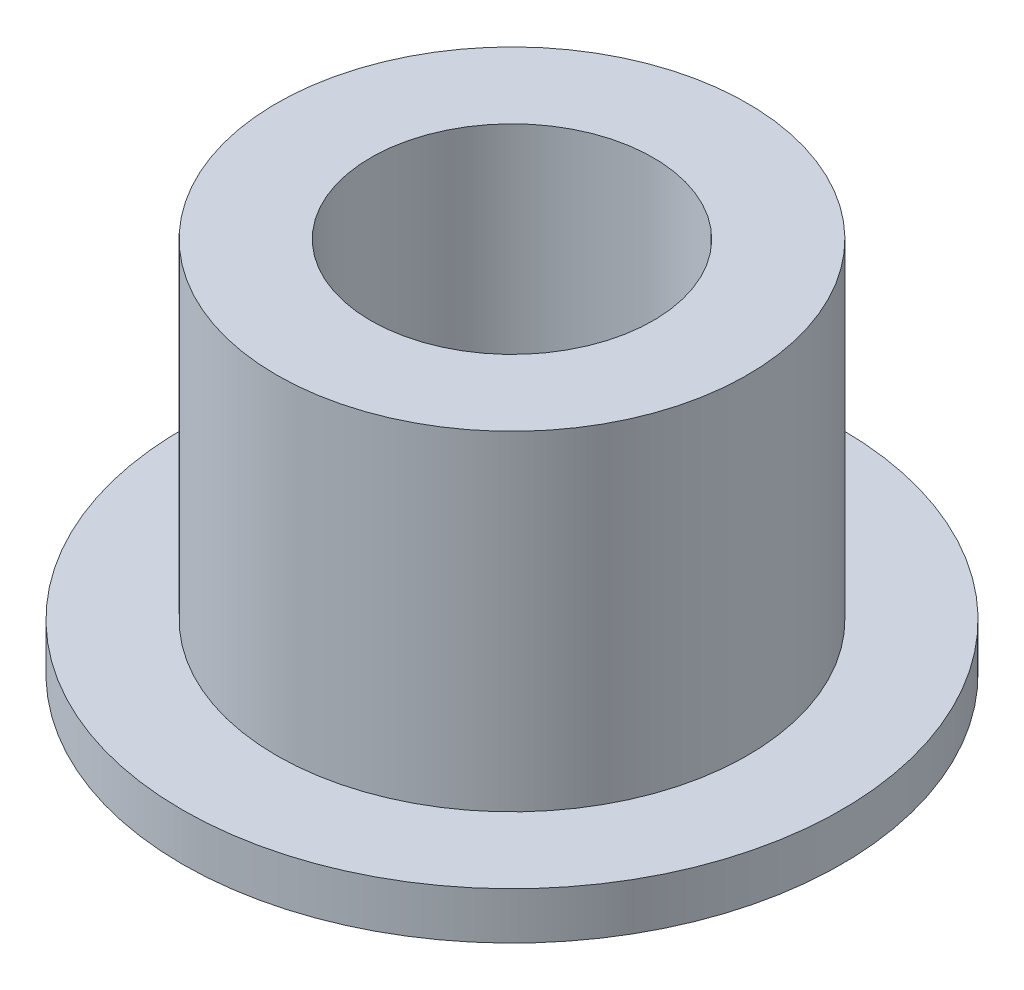
from build123d import *

# Parameters (mm, degrees)
SKETCH1_R           = 11.1125
SKETCH1_R_2         = 4.7625
BOSS_EXTRUDE1_DEPTH = 1.5875
SKETCH2_R           = 7.9375
SKETCH2_R_2         = 4.7625
BOSS_EXTRUDE2_DEPTH = 11.1125


with BuildPart() as part:
    # Sketch1 → Boss-Extrude1 (new body)
    with BuildSketch(Plane(origin=(0, 0, 0), x_dir=(1, 0, 0), z_dir=(0, 1, 0))):
        with Locations(Location((0, 0, 0), (0, 0, 270))):
            Circle(SKETCH1_R)
        with Locations(Location((0, 0, 0), (0, 0, 270))):
            Circle(SKETCH1_R_2, mode=Mode.SUBTRACT)
    extrude(amount=BOSS_EXTRUDE1_DEPTH)

    # Sketch2 → Boss-Extrude2 (add)
    with BuildSketch(Plane(origin=(0, 1.5875, 0), x_dir=(1, 0, 0), z_dir=(0, 1, 0))):
        with Locations(Location((0, 0, 0), (0, 0, 270))):
            Circle(SKETCH2_R)
        with Locations(Location((0, 0, 0), (0, 0, 270))):
            Circle(SKETCH2_R_2, mode=Mode.SUBTRACT)
    extrude(amount=BOSS_EXTRUDE2_DEPTH)


solid = part.part
